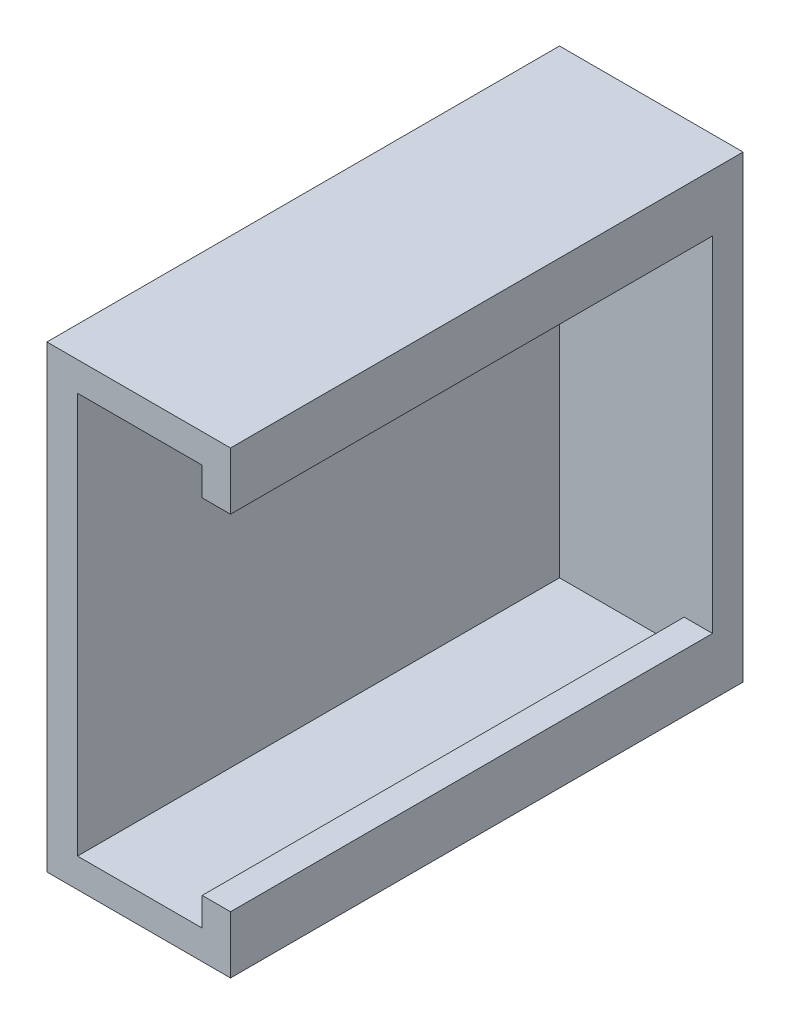
from build123d import *

# Parameters (mm, degrees)
ESQUISSE1_W        = 24
ESQUISSE1_H        = 60
BOSS_EXTRU_1_DEPTH = 4
BOSS_EXTRU_2_DEPTH = 63


with BuildPart() as part:
    # Esquisse1 → Boss.-Extru.1 (new body)
    with BuildSketch(Plane.XY):
        with Locations((12, 30)):
            Rectangle(ESQUISSE1_W, ESQUISSE1_H)
    extrude(amount=BOSS_EXTRU_1_DEPTH)

    # Esquisse2 → Boss.-Extru.2 (add)
    with BuildSketch(Plane.XY.offset(4)):
        Polygon((24, 52.5), (20.3, 52.5), (20.3, 56.2), (4, 56.2), (4, 3.8), (20.3, 3.8), (20.3, 7.5), (24, 7.5), (24, 0), (0, 0), (0, 60), (24, 60), align=None)
    extrude(amount=BOSS_EXTRU_2_DEPTH)


solid = part.part
